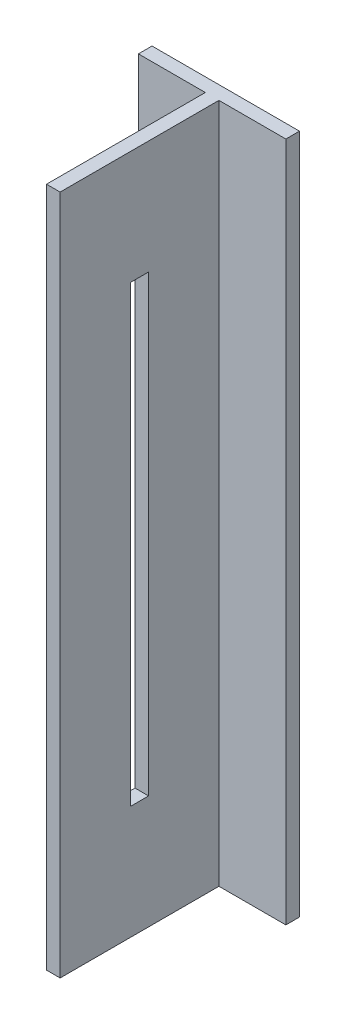
from build123d import *

# Parameters (mm, degrees)
BOSS_EXTRUDE1_DEPTH = 300
SKETCH2_W           = 8
SKETCH2_H           = 200
CUT_EXTRUDE1_DEPTH  = 311.097162193


with BuildPart() as part:
    # Sketch1 → Boss-Extrude1 (new body)
    with BuildSketch(Plane(origin=(0, 0, 0), x_dir=(1, 0, 0), z_dir=(0, 1, 0))):
        Polygon((0, 0), (29.5, 0), (29.5, -70), (35.5, -70), (35.5, 0), (65, 0), (65, 6), (0, 6), align=None)
    extrude(amount=BOSS_EXTRUDE1_DEPTH)

    # Sketch2 → Cut-Extrude1 (cut, through all)
    with BuildSketch(Plane(origin=(35.5, 0, 0), x_dir=(0, 0, -1), z_dir=(1, 0, 0))):
        with Locations((-35, 150)):
            Rectangle(SKETCH2_W, SKETCH2_H)
    extrude(amount=-CUT_EXTRUDE1_DEPTH, mode=Mode.SUBTRACT)


solid = part.part
